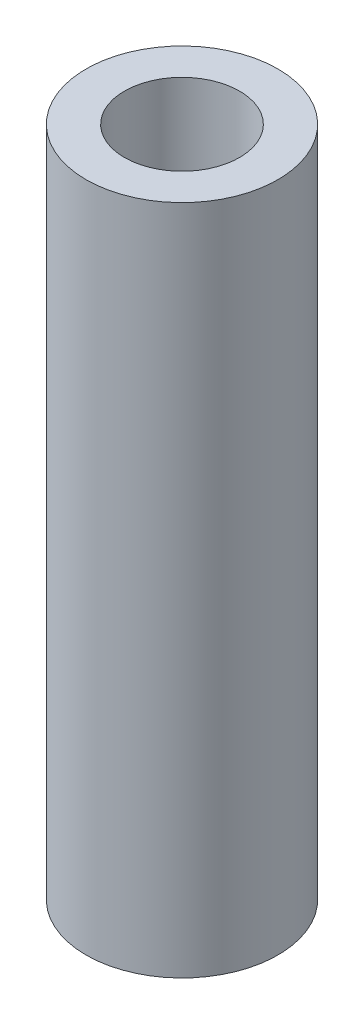
from build123d import *

# Parameters (mm, degrees)
SKETCH1_R           = 5
SKETCH1_R_2         = 3
BOSS_EXTRUDE1_DEPTH = 35


with BuildPart() as part:
    # Sketch1 → Boss-Extrude1 (new body)
    with BuildSketch(Plane(origin=(0, 0, 0), x_dir=(1, 0, 0), z_dir=(0, 1, 0))):
        with Locations(Location((0, 0, 0), (0, 0, 270))):
            Circle(SKETCH1_R)
        with Locations(Location((0, 0, 0), (0, 0, 270))):
            Circle(SKETCH1_R_2, mode=Mode.SUBTRACT)
    extrude(amount=BOSS_EXTRUDE1_DEPTH)


solid = part.part
